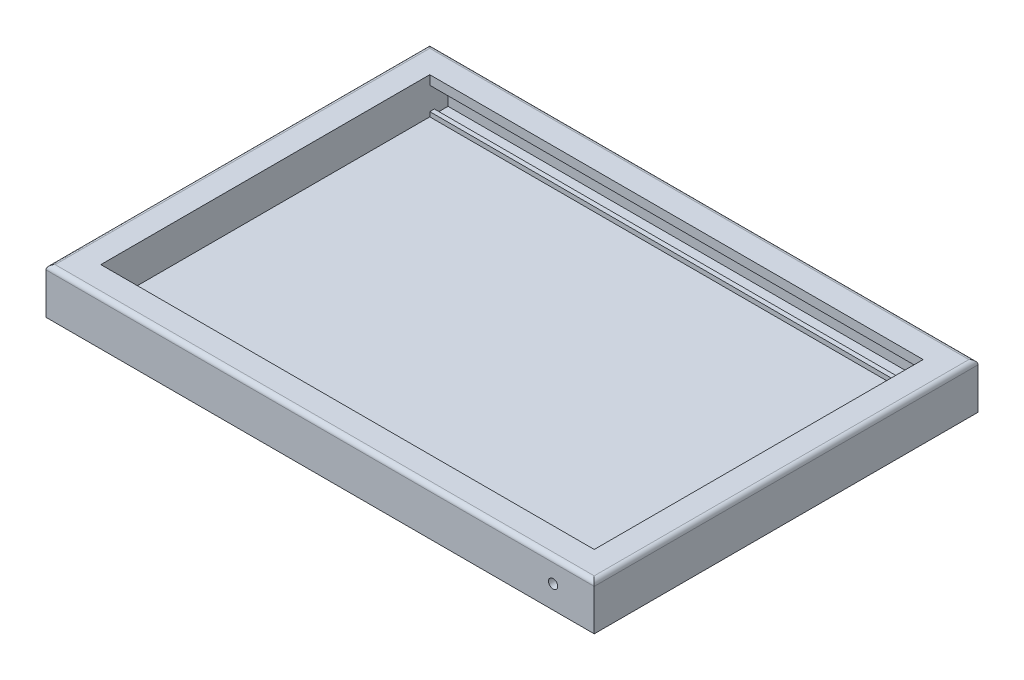
from build123d import *

# Parameters (mm, degrees)
SKETCH_1_W          = 600
SKETCH_1_H          = 420
EXTRUDE_1_DEPTH     = 50
SKETCH_2_W          = 540
SKETCH_2_H          = 360
CUT_EXTRUDE_1_DEPTH = 40
SKETCH_3_W          = 540
SKETCH_3_H          = 30
CUT_EXTRUDE_2_DEPTH = 20
SKETCH_4_W          = 540
SKETCH_4_H          = 30
CUT_EXTRUDE_3_DEPTH = 20
SKETCH_6_W          = 540
SKETCH_6_H          = 5
EXTRUDE_3_DEPTH     = 40
SKETCH_7_W          = 540
SKETCH_7_H          = 5
EXTRUDE_4_DEPTH     = 40
SKETCH_8_W          = 540
SKETCH_8_H          = 30
CUT_EXTRUDE_4_DEPTH = 20
SKETCH_9_W          = 540
SKETCH_9_H          = 30
CUT_EXTRUDE_5_DEPTH = 20
SKETCH_11_W         = 540
SKETCH_11_H         = 5
EXTRUDE_6_DEPTH     = 10
SKETCH_12_R         = 5
CUT_EXTRUDE_6_DEPTH = 711.815967718
FILLET_1_R          = 5


with BuildPart() as part:
    # 스케치1 → 보스-돌출1 (new body)
    with BuildSketch(Plane(origin=(0, 0, 0), x_dir=(1, 0, 0), z_dir=(0, 1, 0))):
        with Locations((-271.278688525, -192)):
            Rectangle(SKETCH_1_W, SKETCH_1_H)
    extrude(amount=EXTRUDE_1_DEPTH)

    # 스케치2 → 컷-돌출1 (cut)
    with BuildSketch(Plane(origin=(0, 50, 0), x_dir=(1, 0, 0), z_dir=(0, 1, 0))):
        with Locations((-271.278688525, -192)):
            Rectangle(SKETCH_2_W, SKETCH_2_H)
    extrude(amount=-CUT_EXTRUDE_1_DEPTH, mode=Mode.SUBTRACT)

    # 스케치3 → 컷-돌출2 (cut)
    with BuildSketch(Plane.XY.offset(12)):
        with Locations((-271.278688525, 25)):
            Rectangle(SKETCH_3_W, SKETCH_3_H)
    extrude(amount=-CUT_EXTRUDE_2_DEPTH, mode=Mode.SUBTRACT)

    # 스케치4 → 컷-돌출3 (cut)
    with BuildSketch(Plane(origin=(0, 0, 372), x_dir=(-1, 0, 0), z_dir=(0, 0, -1))):
        with Locations((271.278688525, 25)):
            Rectangle(SKETCH_4_W, SKETCH_4_H)
    extrude(amount=-CUT_EXTRUDE_3_DEPTH, mode=Mode.SUBTRACT)

    # 스케치6 → 보스-돌출3 (add)
    with BuildSketch(Plane(origin=(0, 50, 0), x_dir=(1, 0, 0), z_dir=(0, 1, 0))):
        with Locations((-271.278688525, -9.5)):
            Rectangle(SKETCH_6_W, SKETCH_6_H)
    extrude(amount=-EXTRUDE_3_DEPTH)

    # 스케치7 → 보스-돌출4 (add)
    with BuildSketch(Plane(origin=(0, 50, 0), x_dir=(1, 0, 0), z_dir=(0, 1, 0))):
        with Locations((-271.278688525, -374.5)):
            Rectangle(SKETCH_7_W, SKETCH_7_H)
    extrude(amount=-EXTRUDE_4_DEPTH)

    # 스케치8 → 컷-돌출4 (cut)
    with BuildSketch(Plane(origin=(0, 0, 372), x_dir=(-1, 0, 0), z_dir=(0, 0, -1))):
        with Locations((271.278688525, 30)):
            Rectangle(SKETCH_8_W, SKETCH_8_H)
    extrude(amount=-CUT_EXTRUDE_4_DEPTH, mode=Mode.SUBTRACT)

    # 스케치9 → 컷-돌출5 (cut)
    with BuildSketch(Plane.XY.offset(12)):
        with Locations((-271.278688525, 30)):
            Rectangle(SKETCH_9_W, SKETCH_9_H)
    extrude(amount=-CUT_EXTRUDE_5_DEPTH, mode=Mode.SUBTRACT)

    # 스케치11 → 보스-돌출6 (add)
    with BuildSketch(Plane(origin=(0, 50, 0), x_dir=(1, 0, 0), z_dir=(0, 1, 0))):
        with Locations((-271.278688525, -9.5)):
            Rectangle(SKETCH_11_W, SKETCH_11_H)
        with Locations((-271.278688525, -374.5)):
            Rectangle(SKETCH_11_W, SKETCH_11_H)
    extrude(amount=-EXTRUDE_6_DEPTH)

    # 스케치12 → 컷-돌출6 (cut, through all)
    with BuildSketch(Plane.XY.offset(402)):
        with Locations((-16.278688525, 25)):
            Circle(SKETCH_12_R)
    extrude(amount=-CUT_EXTRUDE_6_DEPTH, mode=Mode.SUBTRACT)

    # 필렛1
    fillet_1_edges = [part.edges().sort_by_distance(p)[0] for p in [
        (28.721311475, 50, 192),
        (-271.278688525, 50, -18),
        (-571.278688525, 50, 192),
        (-271.278688525, 50, 402),
    ]]
    fillet(fillet_1_edges, radius=FILLET_1_R)


solid = part.part
